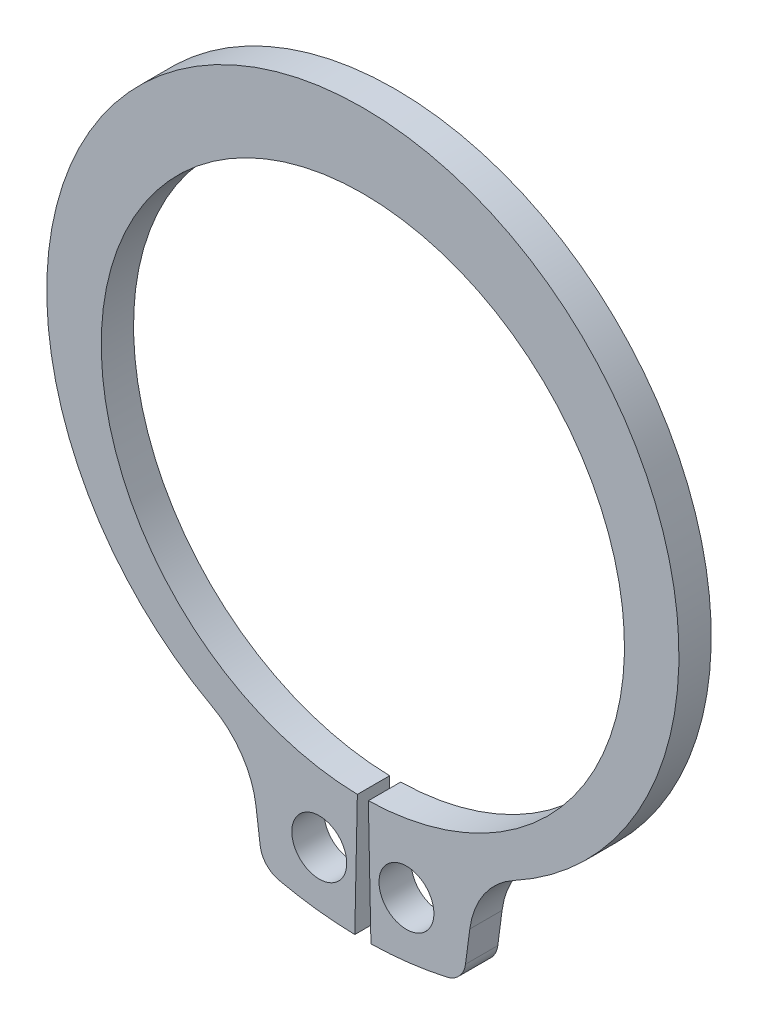
from build123d import *

# Parameters (mm, degrees)
BODYSKE_R  = 0.85
BODY_DEPTH = 1


with BuildPart() as part:
    # BodySke → Body (new body)
    with BuildSketch(Plane.XY):
        with BuildLine():
            Line((0.170168067, -8.098212323), (0.25, -11.89737366))
            ThreePointArc((0.25, -11.89737366), (1.431016081, -11.813644356), (2.597866411, -11.61297077))
            ThreePointArc((2.597866411, -11.61297077), (2.987578055, -11.387224018), (3.177718981, -10.978955492))
            Line((3.177718981, -10.978955492), (3.31090493, -9.967307774))
            ThreePointArc((3.31090493, -9.967307774), (3.753886335, -8.813023088), (4.672486267, -7.985508843))
            ThreePointArc((4.672486267, -7.985508843), (0, 10.4), (-4.672486267, -7.985508843))
            ThreePointArc((-4.672486267, -7.985508843), (-3.753886335, -8.813023088), (-3.31090493, -9.967307774))
            Line((-3.31090493, -9.967307774), (-3.177718981, -10.978955492))
            ThreePointArc((-3.177718981, -10.978955492), (-2.987578055, -11.387224018), (-2.597866411, -11.61297077))
            ThreePointArc((-2.597866411, -11.61297077), (-1.431016081, -11.813644356), (-0.25, -11.89737366))
            Line((-0.25, -11.89737366), (-0.170168067, -8.098212323))
            ThreePointArc((-0.170168067, -8.098212323), (0, 8.1), (0.170168067, -8.098212323))
        make_face()
        with Locations((1.35, -10.110267059)):
            Circle(BODYSKE_R, mode=Mode.SUBTRACT)
        with Locations((-1.35, -10.110267059)):
            Circle(BODYSKE_R, mode=Mode.SUBTRACT)
    extrude(amount=-BODY_DEPTH)


solid = part.part
